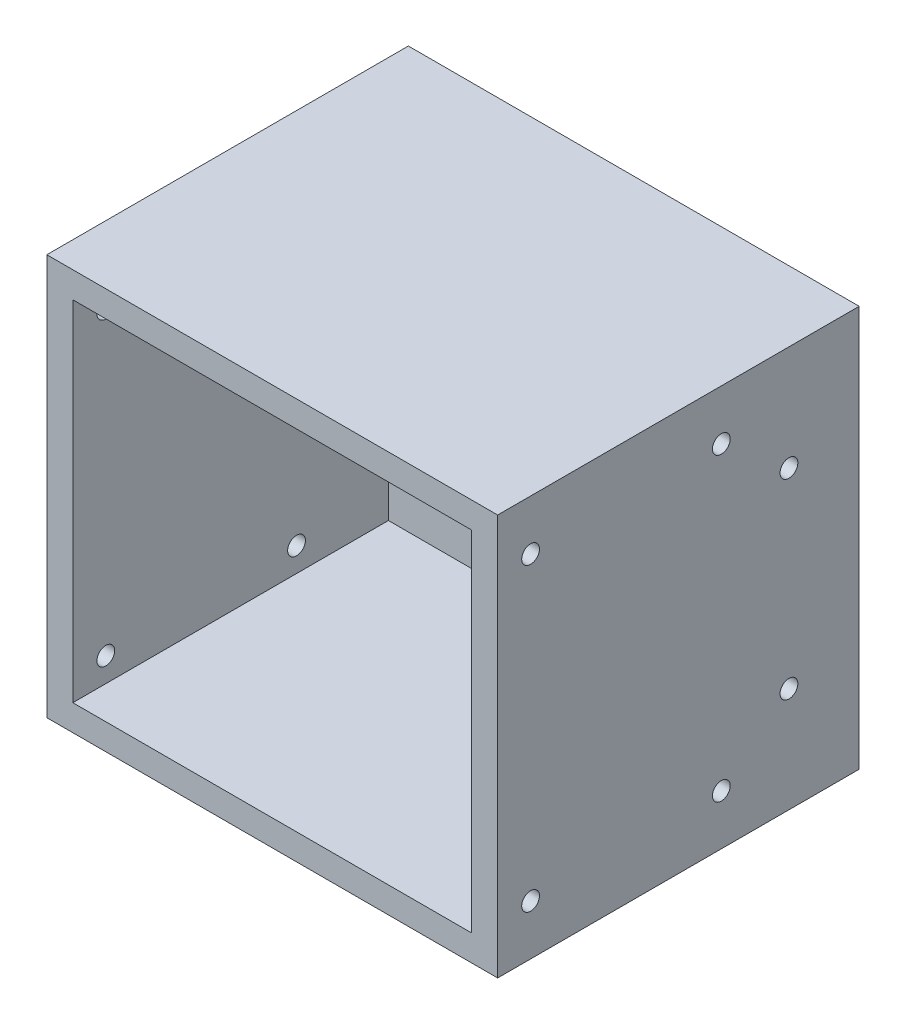
from build123d import *

# Parameters (mm, degrees)
ESBO_O1_W                  = 46
ESBO_O1_H                  = 40.25
ESBO_O1_R                  = 14
RESSALTO_EXTRUS_O1_DEPTH   = 5.3
ESBO_O2_W                  = 41.7
ESBO_O2_H                  = 40.25
ESBO_O2_R                  = 1.025
RESSALTO_EXTRUS_O2_DEPTH   = 3
ESBO_O3_W                  = 49
ESBO_O3_H                  = 41.7
RESSALTO_EXTRUS_O3_DEPTH   = 3
ESBO_O4_W                  = 41.7
ESBO_O4_H                  = 43.25
RESSALTO_EXTRUS_O4_DEPTH   = 3
ESBO_O5_W                  = 52
ESBO_O5_H                  = 41.7
RESSALTO_EXTRUS_O5_DEPTH   = 3
CORTE_EXTRUS_O1_DEPTH      = 66.274234005
CORTE_EXTRUS_O1_DEPTH_BACK = 66.274234005
ESBO_O7_R                  = 1.025


with BuildPart() as part:
    # Esboço1 → Ressalto-extrusão1 (new body)
    with BuildSketch(Plane.XY):
        Rectangle(ESBO_O1_W, ESBO_O1_H)
        Circle(ESBO_O1_R, mode=Mode.SUBTRACT)
    extrude(amount=-RESSALTO_EXTRUS_O1_DEPTH)

    # Esboço2 → Ressalto-extrusão2 (add)
    with BuildSketch(Plane.ZY.offset(23)):
        with Locations((15.55, 0)):
            Rectangle(ESBO_O2_W, ESBO_O2_H)
        with Locations((32.6, 17.325)):
            Circle(ESBO_O2_R, mode=Mode.SUBTRACT)
        with Locations((10.6, 17.325)):
            Circle(ESBO_O2_R, mode=Mode.SUBTRACT)
        with Locations(Location((10.6, -17.325, 0), (0, 0, 180))):
            Circle(ESBO_O2_R, mode=Mode.SUBTRACT)
        with Locations(Location((32.6, -17.325, 0), (0, 0, 180))):
            Circle(ESBO_O2_R, mode=Mode.SUBTRACT)
        with Locations((2.8, 11.025)):
            Circle(ESBO_O2_R, mode=Mode.SUBTRACT)
        with Locations(Location((2.8, -11.025, 0), (0, 0, 180))):
            Circle(ESBO_O2_R, mode=Mode.SUBTRACT)
    extrude(amount=RESSALTO_EXTRUS_O2_DEPTH)

    # Esboço3 → Ressalto-extrusão3 (add)
    with BuildSketch(Plane(origin=(0, 20.125, 0), x_dir=(1, 0, 0), z_dir=(0, 1, 0))):
        with Locations((-1.5, -15.55)):
            Rectangle(ESBO_O3_W, ESBO_O3_H)
    extrude(amount=RESSALTO_EXTRUS_O3_DEPTH)

    # Esboço4 → Ressalto-extrusão4 (add)
    with BuildSketch(Plane(origin=(23, 0, 0), x_dir=(0, 0, -1), z_dir=(1, 0, 0))):
        with Locations((-15.55, 1.5)):
            Rectangle(ESBO_O4_W, ESBO_O4_H)
    extrude(amount=RESSALTO_EXTRUS_O4_DEPTH)

    # Esboço5 → Ressalto-extrusão5 (add)
    with BuildSketch(Plane(origin=(0, -20.125, 0), x_dir=(-1, 0, 0), z_dir=(0, -1, 0))):
        with Locations((0, -15.55)):
            Rectangle(ESBO_O5_W, ESBO_O5_H)
    extrude(amount=RESSALTO_EXTRUS_O5_DEPTH)

    # Esboço7 → Corte-extrusão1 (cut, two sides: drawn at the far end of the back side and taken through both)
    with BuildSketch(Plane.ZY.offset(23).offset(-CORTE_EXTRUS_O1_DEPTH_BACK)):
        with Locations((2.8, 11.025)):
            Circle(ESBO_O7_R)
        with Locations((10.6, 17.325)):
            Circle(ESBO_O7_R)
        with Locations((32.6, 17.325)):
            Circle(ESBO_O7_R)
        with Locations(Location((2.8, -11.025, 0), (0, 0, 180))):
            Circle(ESBO_O7_R)
        with Locations(Location((10.6, -17.325, 0), (0, 0, 180))):
            Circle(ESBO_O7_R)
        with Locations(Location((32.6, -17.325, 0), (0, 0, 180))):
            Circle(ESBO_O7_R)
    extrude(amount=CORTE_EXTRUS_O1_DEPTH + CORTE_EXTRUS_O1_DEPTH_BACK, mode=Mode.SUBTRACT)


solid = part.part
